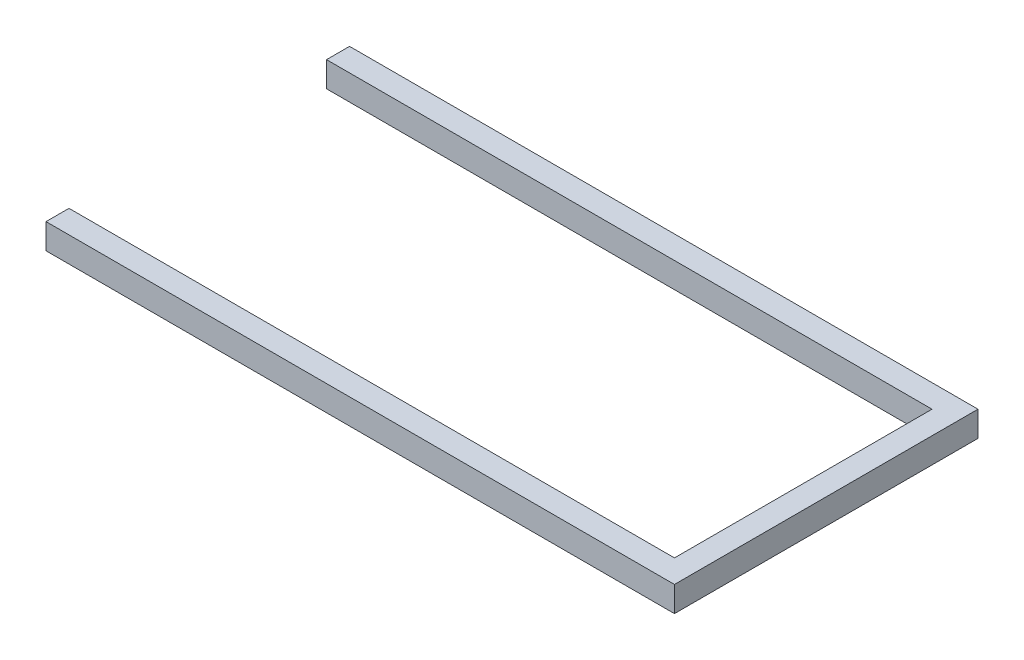
from build123d import *

# Parameters (mm, degrees)
BOSS_EXTRUDE1_DEPTH = 2.75


with BuildPart() as part:
    # Sketch1 → Boss-Extrude1 (new body)
    with BuildSketch(Plane(origin=(0, 0, 0), x_dir=(1, 0, 0), z_dir=(0, 1, 0))):
        Polygon((-2.5, -2.5), (-2.5, 0), (0, 0), (63.325, 0), (63.325, 28), (0, 28), (-2.5, 28), (-2.5, 30.5), (65.825, 30.5), (65.825, -2.5), align=None)
    extrude(amount=BOSS_EXTRUDE1_DEPTH)


solid = part.part
